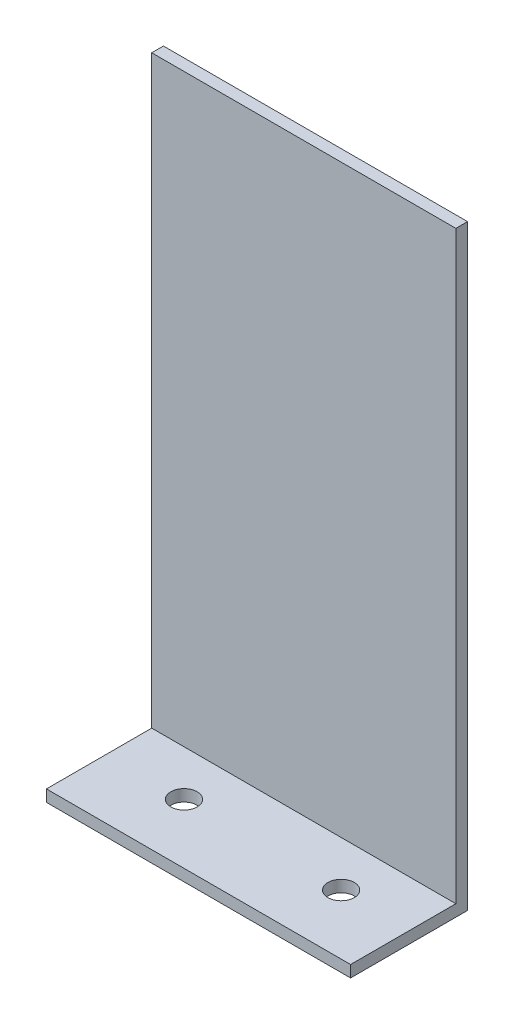
from build123d import *

# Parameters (mm, degrees)
ESQUISSE1_W             = 52
ESQUISSE1_H             = 102
BOSS_EXTRU_1_DEPTH      = 20
ESQUISSE2_W             = 66.008627658
ESQUISSE2_H             = 40.946179855
ENL_V_MAT_EXTRU_1_DEPTH = 100
D_GAGEMENT_M42_D        = 4.5


with BuildPart() as part:
    # Esquisse1 → Boss.-Extru.1 (new body)
    with BuildSketch(Plane.XY):
        Rectangle(ESQUISSE1_W, ESQUISSE1_H)
    extrude(amount=BOSS_EXTRU_1_DEPTH)

    # Esquisse2 → Enlèv. mat.-Extru.1 (cut)
    with BuildSketch(Plane(origin=(0, 51, 0), x_dir=(1, 0, 0), z_dir=(0, 1, 0))):
        with Locations((1.405901571, -22.473089928)):
            Rectangle(ESQUISSE2_W, ESQUISSE2_H)
    extrude(amount=-ENL_V_MAT_EXTRU_1_DEPTH, mode=Mode.SUBTRACT)

    # Dégagement M42 (through all)
    with Locations(Plane(origin=(0, -49, 0), x_dir=(1, 0, 0), z_dir=(0, 1, 0))):
        with Locations((-12.695679618, -9.785063319), (14.163037838, -9.785063319)):
            Hole(D_GAGEMENT_M42_D / 2)


solid = part.part
